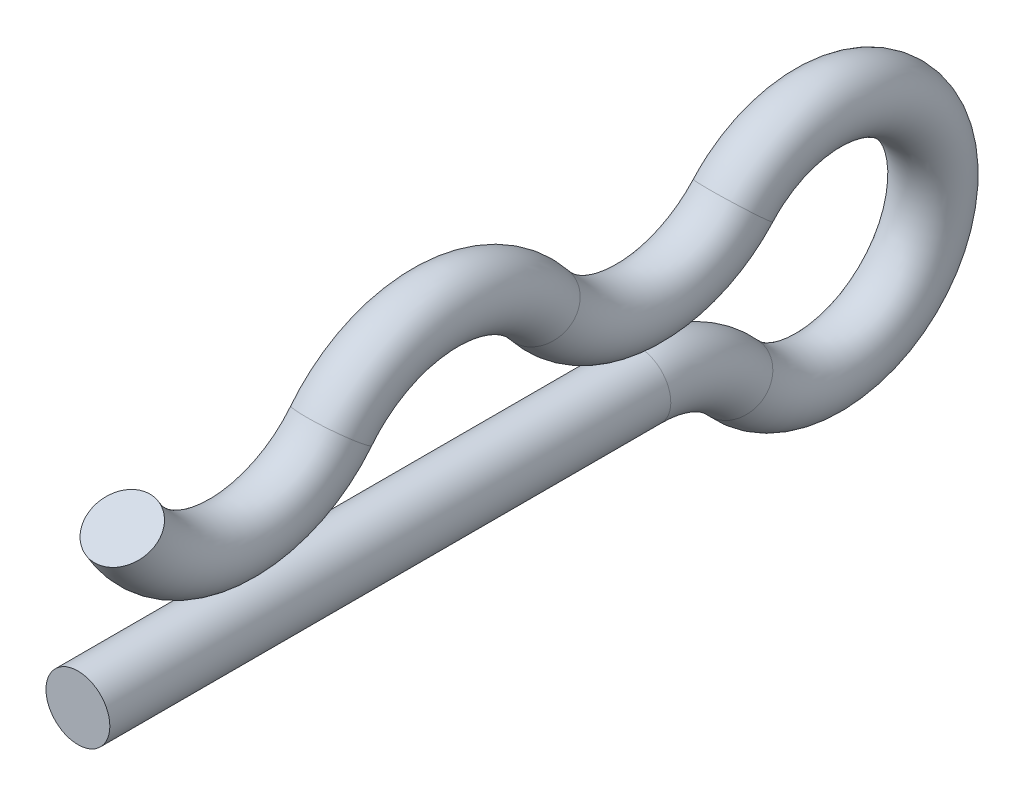
from build123d import *

# Parameters (mm, degrees)
SKETCH2_R = 0.6858


with BuildPart() as part:
    # Sweep1: sweep along a path in Sketch3
    with BuildLine(Plane(origin=(0, 0, 0), x_dir=(0, 0, -1), z_dir=(1, 0, 0))) as sweep1_path:
        Line((-15.9004, -0.7493), (-3.85292839, -0.7493))
        ThreePointArc((-3.85292839, -0.7493), (-2.74600295, -0.984467198), (-1.830292782, -1.649344953))
        ThreePointArc((-1.830292782, -1.649344953), (2.4638, 0), (-1.830292782, 1.649344953))
        ThreePointArc((-1.830292782, 1.649344953), (-3.937171972, 0.750603602), (-5.984427864, 1.7779396))
        ThreePointArc((-5.984427864, 1.7779396), (-8.22144307, 2.8575), (-10.458458276, 1.7779396))
        ThreePointArc((-10.458458276, 1.7779396), (-12.791190363, 0.756746608), (-14.9479, 2.110658593))
    # Sketch2 → Sweep1 (sweep)
    with BuildSketch(Plane.XY.offset(15.9004)):
        with Locations((0, -0.7493)):
            Circle(SKETCH2_R)
    sweep(path=sweep1_path.line)


solid = part.part
